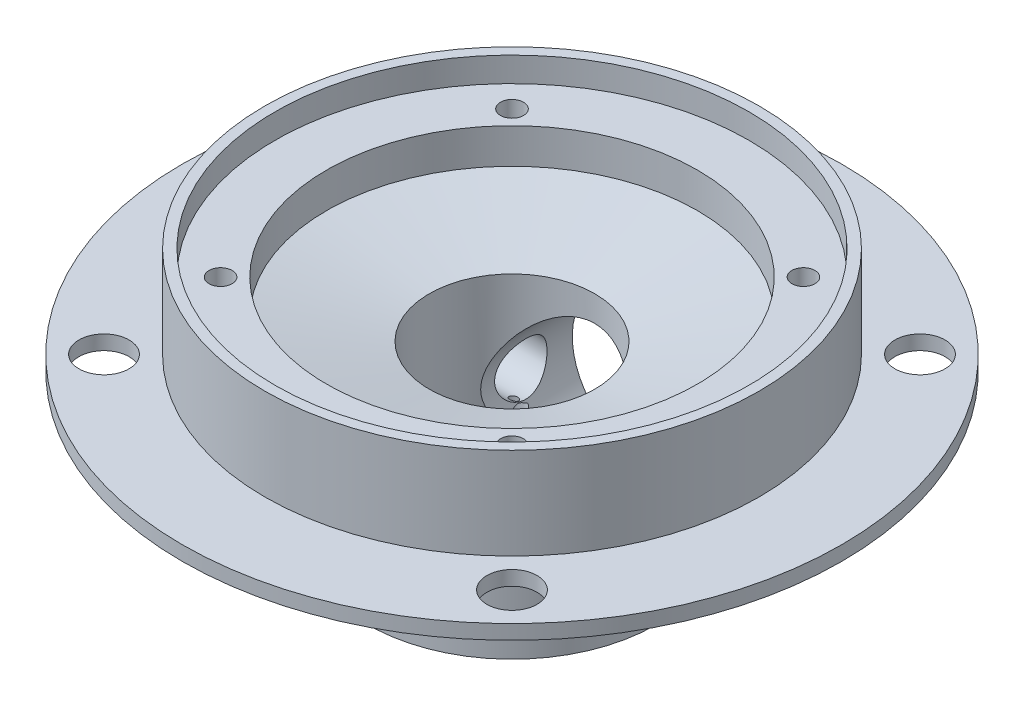
from build123d import *

# Parameters (mm, degrees)
BOSS_EXTRUDE1_START            = 11.1125
SKETCH2_R                      = 6.3754
BOSS_EXTRUDE1_DEPTH            = 11.1125
CUT_EXTRUDE1_REACH             = 49.031
CUT_EXTRUDE1_END_RADIUS        = 6.3754
SKETCH3_R                      = 5.5499
CUT_EXTRUDE1_DIRECTION_2_DEPTH = 48.031343202
F_10_32_TAPPED_HOLE3_D         = 4.0386
F_24_0_152_DIAMETER_HOLE1_D    = 3.8608
F_2_56_TAPPED_HOLE1_D          = 1.778
F_2_56_TAPPED_HOLE1_DEPTH      = 4.064
F_2_56_TAPPED_HOLE1_TIP        = 0.53416509
F_2_56_TAPPED_HOLE2_D          = 1.778
F_2_56_TAPPED_HOLE2_DEPTH      = 3.52983491
F_2_56_TAPPED_HOLE2_TIP        = 0.53416509


with BuildPart() as part:
    # Sketch1 → Revolve1 (revolve)
    with BuildSketch(Plane.XY, mode=Mode.PRIVATE) as revolve1_sk:
        Polygon((12.7508, 8.879591729), (15.08125, 8.879591729), (15.08125, 9.133591729), (25.4, 9.133591729), (25.4, 10.251191729), (19.0373, 10.251191729), (19.0373, 17.312391729), (18.25625, 17.312391729), (18.25625, 15.407391729), (14.2875, 15.407391729), (14.2875, 12.7), (6.3754, 11.1125), (6.3754, 8.879591729), align=None)
    revolve(revolve1_sk.sketch.rotate(Axis((0, -1.389169925, 0), (0, 1, 0)), 90), axis=Axis((0, -1.389169925, 0), (0, 1, 0)))

    # Sketch2 → Boss-Extrude1 (add)
    with BuildSketch(Plane.XZ.offset(-8.879591729).offset(BOSS_EXTRUDE1_START)):
        with BuildLine():
            Line((-11.1125, 0), (-11.1125, -10.195903359))
            Line((-11.1125, -10.195903359), (11.1125, -10.195903359))
            Line((11.1125, -10.195903359), (11.1125, 0))
            ThreePointArc((11.1125, 0), (0, 11.1125), (-11.1125, 0))
        make_face()
        with Locations(Location((0, 0, 0), (0, 0, 270))):
            Circle(SKETCH2_R, mode=Mode.SUBTRACT)
    extrude(amount=-BOSS_EXTRUDE1_DEPTH)

    # Cut-Extrude1: up to this cylinder (the profile starts outside it)
    cut_extrude1_end = Plane(origin=(0, 3.577342, 0), z_dir=(0, -1, 0)) * Cylinder(CUT_EXTRUDE1_END_RADIUS, 111.8128, mode=Mode.PRIVATE)
    # Sketch3 → Cut-Extrude1 (cut, up to the surface)
    with BuildSketch(Plane(origin=(0, 0, -10.195903359), x_dir=(-1, 0, 0), z_dir=(0, 0, -1)), mode=Mode.PRIVATE) as cut_extrude1_sk1:
        with Locations(Location((0, 3.577341729, 0), (0, 0, 90))):
            Circle(SKETCH3_R)
    cut_extrude1_tool1 = extrude(cut_extrude1_sk1.sketch, amount=-CUT_EXTRUDE1_REACH, mode=Mode.PRIVATE) - cut_extrude1_end
    add(cut_extrude1_tool1.solids().sort_by_distance((0, 3.577342, -10.195903))[0], mode=Mode.SUBTRACT)

    # Sketch3 → Cut-Extrude1 direction 2 (cut)
    with BuildSketch(Plane(origin=(0, 0, -10.195903359), x_dir=(-1, 0, 0), z_dir=(0, 0, -1))):
        with Locations(Location((0, 3.577341729, 0), (0, 0, 90))):
            Circle(SKETCH3_R)
    extrude(amount=CUT_EXTRUDE1_DIRECTION_2_DEPTH, mode=Mode.SUBTRACT)

    # #10-32 Tapped Hole3 (through all)
    with Locations(Plane.ZY.offset(11.1125)):
        with Locations((-6.227153359, 3.577341729)):
            Hole(F_10_32_TAPPED_HOLE3_D / 2)

    # #24 (0.152) Diameter Hole1 (through all)
    with Locations(Plane(origin=(0, 10.251191729, 0), x_dir=(1, 0, 0), z_dir=(0, 1, 0))):
        with Locations((-15.715448212, 15.715448212), (15.715448212, 15.715448212), (15.715448212, -15.715448212), (-15.715448212, -15.715448212)):
            Hole(F_24_0_152_DIAMETER_HOLE1_D / 2)

    # #2-56 Tapped Hole1
    with Locations(Plane(origin=(0, 15.407391729, 0), x_dir=(1, 0, 0), z_dir=(0, 1, 0))):
        with Locations((-11.225320151, 11.225320151), (11.225320151, 11.225320151), (11.225320151, -11.225320151), (-11.225320151, -11.225320151)):
            Hole(F_2_56_TAPPED_HOLE1_D / 2, depth=F_2_56_TAPPED_HOLE1_DEPTH)
            with Locations((0, 0, -(F_2_56_TAPPED_HOLE1_DEPTH + F_2_56_TAPPED_HOLE1_TIP / 2))):  # 118° drill point
                Cone(0, F_2_56_TAPPED_HOLE1_D / 2, F_2_56_TAPPED_HOLE1_TIP, mode=Mode.SUBTRACT)

    # #2-56 Tapped Hole2
    with Locations(Plane.XZ.offset(2.232908271)):
        with Locations((-5.612660076, 5.612660076), (5.612660076, 5.612660076), (5.612660076, -5.612660076), (-5.612660076, -5.612660076)):
            Hole(F_2_56_TAPPED_HOLE2_D / 2, depth=F_2_56_TAPPED_HOLE2_DEPTH)
            with Locations((0, 0, -(F_2_56_TAPPED_HOLE2_DEPTH + F_2_56_TAPPED_HOLE2_TIP / 2))):  # 118° drill point
                Cone(0, F_2_56_TAPPED_HOLE2_D / 2, F_2_56_TAPPED_HOLE2_TIP, mode=Mode.SUBTRACT)


solid = part.part
